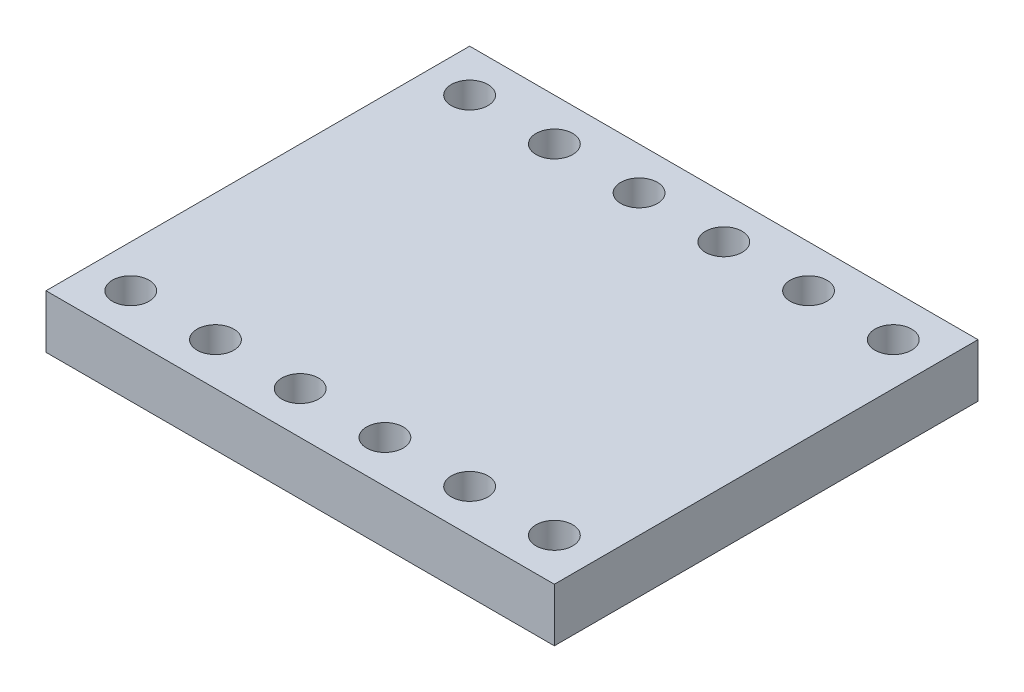
from build123d import *

# Parameters (mm, degrees)
SKETCH1_W            = 15.24
SKETCH1_H            = 12.7
BOSS_EXTRUDE1_DEPTH  = 0.8
SKETCH2_R            = 0.55
CUT_EXTRUDE1_DEPTH   = 11.04723345
LPATTERN1_COUNT      = 6
LPATTERN1_PITCH      = 2.54
LPATTERN1_COUNT_DIR2 = 2
LPATTERN1_PITCH_DIR2 = 10.16


with BuildPart() as part:
    # Sketch1 → Boss-Extrude1 (new, symmetric)
    with BuildSketch(Plane(origin=(0, 0, 0), x_dir=(1, 0, 0), z_dir=(0, 1, 0))):
        Rectangle(SKETCH1_W, SKETCH1_H)
    extrude(amount=BOSS_EXTRUDE1_DEPTH, both=True)

    # Sketch2 → Cut-Extrude1 (cut, through all)
    with BuildSketch(Plane(origin=(0, 0.8, 0), x_dir=(1, 0, 0), z_dir=(0, 1, 0))):
        with Locations(Location((-6.35, -5.08, 0), (0, 0, 270))):
            Circle(SKETCH2_R)
    cut_extrude1 = extrude(amount=-CUT_EXTRUDE1_DEPTH, mode=Mode.SUBTRACT)

    # LPattern1: Cut-Extrude1 6 × 2
    with Locations(*[(i * LPATTERN1_PITCH, 0, -j * LPATTERN1_PITCH_DIR2) for i in range(LPATTERN1_COUNT) for j in range(LPATTERN1_COUNT_DIR2) if (i, j) != (0, 0)]):
        add(cut_extrude1, mode=Mode.SUBTRACT)


solid = part.part
